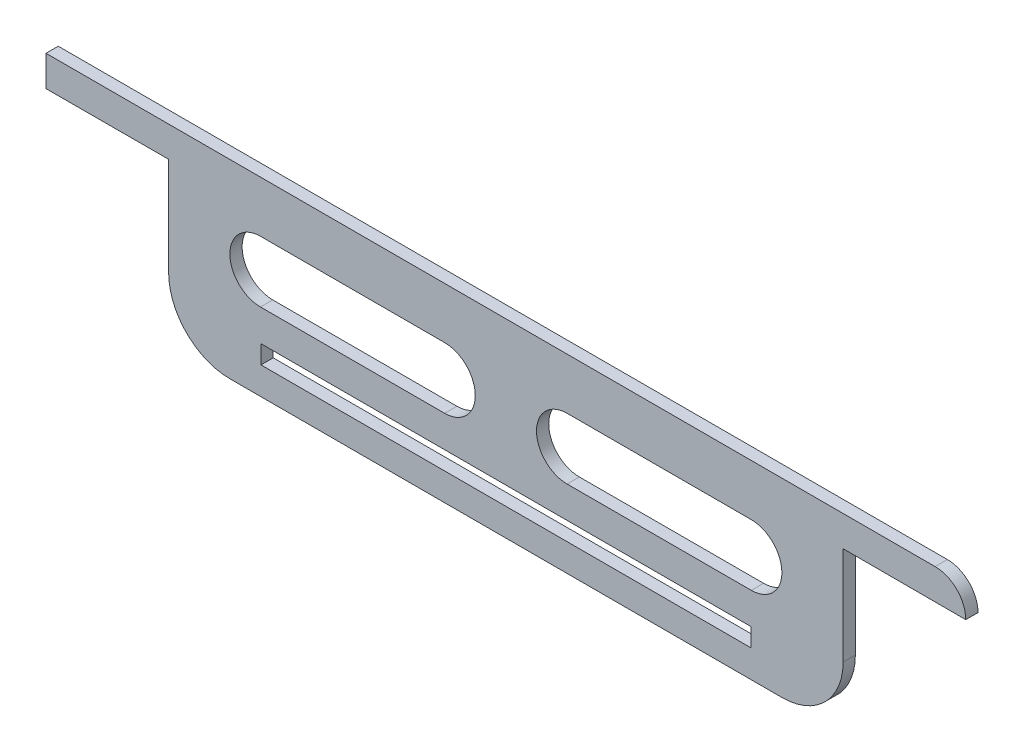
from build123d import *

# Parameters (mm, degrees)
SKETCH1_W           = 80
SKETCH1_H           = 3
BOSS_EXTRUDE1_DEPTH = 2


with BuildPart() as part:
    # Sketch1 → Boss-Extrude1 (new body)
    # profile 1 of 2: a face of its own
    with BuildSketch(Plane.XY):
        with BuildLine():
            Line((-75.109333092, -2.496355564), (-75.109333092, -2.503644436))
            Line((-75.109333092, -2.503644436), (-55.0801776, -2.478133382))
            Line((-55.0801776, -2.478133382), (-55.0801776, -18.521866618))
            ThreePointArc((-55.0801776, -18.521866618), (-52.151245412, -25.59293443), (-45.0801776, -28.521866618))
            Line((-45.0801776, -28.521866618), (45.0801776, -28.521866618))
            ThreePointArc((45.0801776, -28.521866618), (52.151245412, -25.59293443), (55.0801776, -18.521866618))
            Line((55.0801776, -18.521866618), (55.0801776, -2.478133382))
            Line((55.0801776, -2.478133382), (75.109333092, -2.503644436))
            Line((75.109333092, -2.503644436), (75.109333092, -2.496355564))
            ThreePointArc((75.109333092, -2.496355564), (73.644866997, 1.039178342), (70.109333092, 2.503644436))
            Line((70.109333092, 2.503644436), (-70.109333092, 2.503644436))
            Line((-70.109333092, 2.503644436), (-75.109333092, 2.503644436))
            Line((-75.109333092, 2.503644436), (-75.109333092, -2.496355564))
        make_face()
        with Locations((0, -22.521866618)):
            Rectangle(SKETCH1_W, SKETCH1_H, mode=Mode.SUBTRACT)
        with BuildLine():
            ThreePointArc((-40.0801776, -15.868057699), (-45.0801776, -10.868057699), (-40.0801776, -5.868057699))
            Line((-40.0801776, -5.868057699), (-10, -5.868057699))
            ThreePointArc((-10, -5.868057699), (-5, -10.868057699), (-10, -15.868057699))
            Line((-10, -15.868057699), (-40.0801776, -15.868057699))
        make_face(mode=Mode.SUBTRACT)
        with BuildLine():
            ThreePointArc((10, -15.868057699), (5, -10.868057699), (10, -5.868057699))
            Line((10, -5.868057699), (40.0801776, -5.868057699))
            ThreePointArc((40.0801776, -5.868057699), (45.0801776, -10.868057699), (40.0801776, -15.868057699))
            Line((40.0801776, -15.868057699), (10, -15.868057699))
        make_face(mode=Mode.SUBTRACT)
    # profile 2 of 2: a face of its own
    with BuildSketch(Plane.XY):
        with BuildLine():
            Line((-75.109333092, -2.496355564), (-75.109333092, -2.503644436))
            Line((-75.109333092, -2.503644436), (-55.0801776, -2.478133382))
            Line((-55.0801776, -2.478133382), (-55.0801776, -18.521866618))
            ThreePointArc((-55.0801776, -18.521866618), (-52.151245412, -25.59293443), (-45.0801776, -28.521866618))
            Line((-45.0801776, -28.521866618), (45.0801776, -28.521866618))
            ThreePointArc((45.0801776, -28.521866618), (52.151245412, -25.59293443), (55.0801776, -18.521866618))
            Line((55.0801776, -18.521866618), (55.0801776, -2.478133382))
            Line((55.0801776, -2.478133382), (75.109333092, -2.503644436))
            Line((75.109333092, -2.503644436), (75.109333092, -2.496355564))
            ThreePointArc((75.109333092, -2.496355564), (73.644866997, 1.039178342), (70.109333092, 2.503644436))
            Line((70.109333092, 2.503644436), (-70.109333092, 2.503644436))
            Line((-70.109333092, 2.503644436), (-75.109333092, 2.503644436))
            Line((-75.109333092, 2.503644436), (-75.109333092, -2.496355564))
        make_face()
        with Locations((0, -22.521866618)):
            Rectangle(SKETCH1_W, SKETCH1_H, mode=Mode.SUBTRACT)
        with BuildLine():
            ThreePointArc((-40.0801776, -15.868057699), (-45.0801776, -10.868057699), (-40.0801776, -5.868057699))
            Line((-40.0801776, -5.868057699), (-10, -5.868057699))
            ThreePointArc((-10, -5.868057699), (-5, -10.868057699), (-10, -15.868057699))
            Line((-10, -15.868057699), (-40.0801776, -15.868057699))
        make_face(mode=Mode.SUBTRACT)
        with BuildLine():
            ThreePointArc((10, -15.868057699), (5, -10.868057699), (10, -5.868057699))
            Line((10, -5.868057699), (40.0801776, -5.868057699))
            ThreePointArc((40.0801776, -5.868057699), (45.0801776, -10.868057699), (40.0801776, -15.868057699))
            Line((40.0801776, -15.868057699), (10, -15.868057699))
        make_face(mode=Mode.SUBTRACT)
    extrude(amount=BOSS_EXTRUDE1_DEPTH)


solid = part.part
